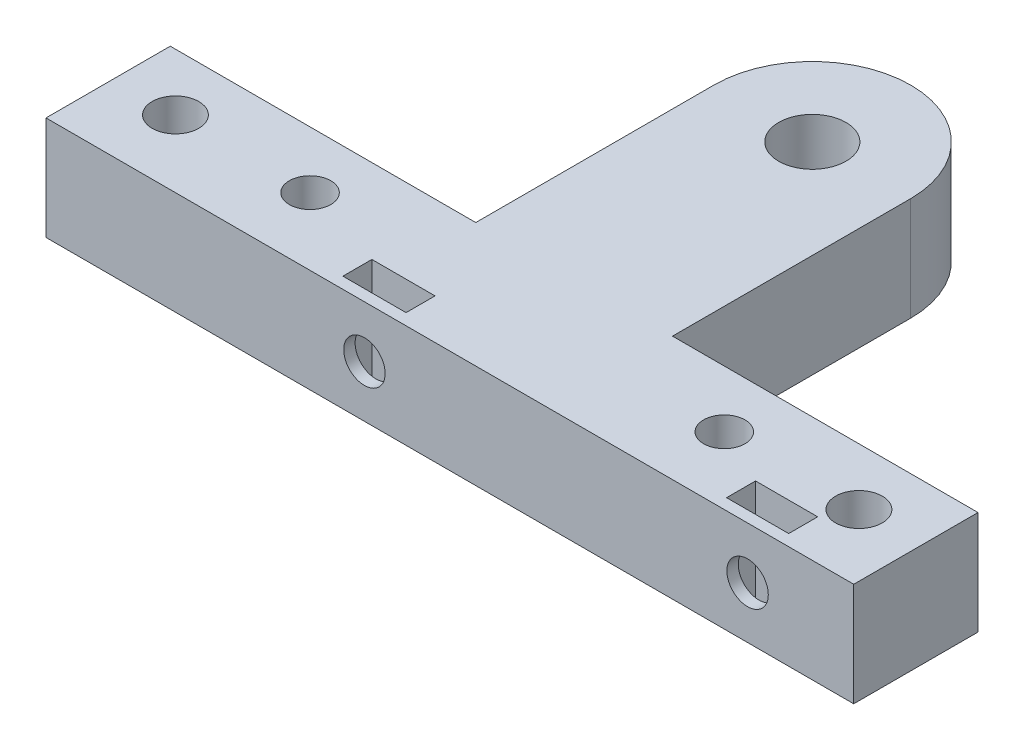
from build123d import *

# Parameters (mm, degrees)
IZIM1_R                     = 3.25
IZIM1_R_2                   = 2.25
Y_KSEKLIK_EKSTR_ZYON1_DEPTH = 10
KES_EKSTR_ZYON1_DEPTH       = 5
IZIM3_R                     = 2
KES_EKSTR_ZYON4_DEPTH       = 4
IZIM4_W                     = 6.1
IZIM4_H                     = 2.8
IZIM4_W_2                   = 6
KES_EKSTR_ZYON5_DEPTH       = 10
IZIM5_R                     = 1.65
KES_EKSTR_ZYON6_DEPTH       = 5
IZIM6_R                     = 2
KES_EKSTR_ZYON7_DEPTH       = 13


with BuildPart() as part:
    # Çizim1 → Yükseklik-Ekstrüzyon1 (new body)
    with BuildSketch(Plane(origin=(0, 0, 0), x_dir=(1, 0, 0), z_dir=(0, 1, 0))):
        with BuildLine():
            Line((9.5, 6), (39, 6))
            Line((39, 6), (39, -6))
            Line((39, -6), (-39, -6))
            Line((-39, -6), (-39, 6))
            Line((-39, 6), (-9.5, 6))
            Line((-9.5, 6), (-9.5, 29))
            ThreePointArc((-9.5, 29), (0, 38.5), (9.5, 29))
            Line((9.5, 29), (9.5, 6))
        make_face()
        with Locations(Location((0, 29, 0), (0, 0, 270))):
            Circle(IZIM1_R, mode=Mode.SUBTRACT)
        with Locations(Location((-33, 0.5, 0), (0, 0, 270))):
            Circle(IZIM1_R_2, mode=Mode.SUBTRACT)
        with Locations(Location((33, 0.5, 0), (0, 0, 90))):
            Circle(IZIM1_R_2, mode=Mode.SUBTRACT)
    extrude(amount=Y_KSEKLIK_EKSTR_ZYON1_DEPTH)

    # Çizim2 → Kes-Ekstrüzyon1 (cut)
    with BuildSketch(Plane.XZ):
        Polygon((5.75, -29), (2.875, -24.020353928), (-2.875, -24.020353928), (-5.75, -29), (-2.875, -33.979646072), (2.875, -33.979646072), align=None)
    extrude(amount=-KES_EKSTR_ZYON1_DEPTH, mode=Mode.SUBTRACT)

    # Çizim3 → Kes-Ekstrüzyon4 (cut)
    with BuildSketch(Plane.XY.offset(6)):
        with Locations((-8.25, 5)):
            Circle(IZIM3_R)
        with Locations((28.75, 5)):
            Circle(IZIM3_R)
    extrude(amount=-KES_EKSTR_ZYON4_DEPTH, mode=Mode.SUBTRACT)

    # Çizim4 → Kes-Ekstrüzyon5 (cut)
    with BuildSketch(Plane(origin=(0, 10, 0), x_dir=(1, 0, 0), z_dir=(0, 1, 0))):
        with Locations((-8.380873527, -3.5)):
            Rectangle(IZIM4_W, IZIM4_H)
        with Locations((28.619126473, -3.5)):
            Rectangle(IZIM4_W_2, IZIM4_H)
    extrude(amount=-KES_EKSTR_ZYON5_DEPTH, mode=Mode.SUBTRACT)

    # Çizim5 → Kes-Ekstrüzyon6 (cut)
    with BuildSketch(Plane.XY.offset(2)):
        with Locations((-8.25, 5)):
            Circle(IZIM5_R)
        with Locations((28.75, 5)):
            Circle(IZIM5_R)
    extrude(amount=-KES_EKSTR_ZYON6_DEPTH, mode=Mode.SUBTRACT)

    # Çizim6 → Kes-Ekstrüzyon7 (cut)
    with BuildSketch(Plane(origin=(0, 10, 0), x_dir=(1, 0, 0), z_dir=(0, 1, 0))):
        with Locations(Location((-20, 0.5, 0), (0, 0, 270))):
            Circle(IZIM6_R)
        with Locations(Location((20, 0.5, 0), (0, 0, 270))):
            Circle(IZIM6_R)
    extrude(amount=-KES_EKSTR_ZYON7_DEPTH, mode=Mode.SUBTRACT)


solid = part.part
